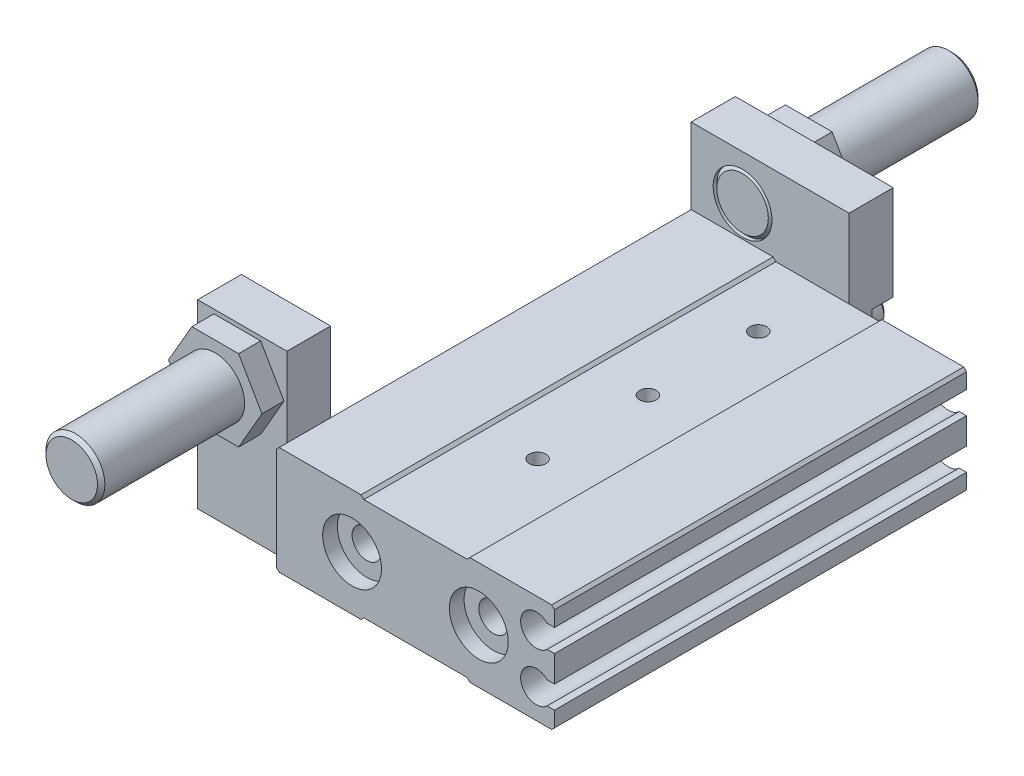
from build123d import *

# Parameters (mm, degrees)
BASE_EXTRUDE_START               = -56
BASE_EXTRUDE_DEPTH               = 56
SKETCH2_R                        = 4
CUT_EXTRUDE1_DEPTH               = 54.7
SKETCH4_R                        = 4
BOSS_EXTRUDE1_DEPTH              = 10
CUT_EXTRUDE3_REACH               = 59.681
SKETCH19_R                       = 2
F_4_40_TAPPED_HOLE2_D            = 2.2606
F_4_40_TAPPED_HOLE2_CBORE_D      = 2.8448
F_4_40_TAPPED_HOLE2_CBORE_DEPTH  = 5.6896
F_3_48_TAPPED_HOLE1_D            = 2.0828
F_3_48_TAPPED_HOLE1_DEPTH        = 7.3025
F_3_48_TAPPED_HOLE1_CBORE_D      = 2.5146
F_3_48_TAPPED_HOLE1_CBORE_DEPTH  = 5.0292
F_3_48_TAPPED_HOLE1_TIP          = 0.625736249
HOLE1_D                          = 3.1877
HOLE1_DEPTH                      = 2.54
CUT_EXTRUDE4_DEPTH               = 2.5
F_10_32_TAPPED_HOLE1_D           = 4.0386
F_10_32_TAPPED_HOLE1_DEPTH       = 12.0293892
F_10_32_TAPPED_HOLE1_CBORE_D     = 4.826
F_10_32_TAPPED_HOLE1_CBORE_DEPTH = 9.652
F_10_32_TAPPED_HOLE1_TIP         = 1.213317848
SKETCH30_W                       = 21.46
SKETCH30_H                       = 24.23
BOSS_EXTRUDE2_DEPTH              = 6
CUT_EXTRUDE9_DEPTH               = 2.87
BOSS_EXTRUDE3_DEPTH              = 3
SKETCH35_R                       = 2.032
BOSS_EXTRUDE5_DEPTH              = 3
BOSS_EXTRUDE6_DEPTH              = 5.94
BOSS_EXTRUDE7_DEPTH              = 3
CUT_EXTRUDE7_REACH               = 77.879
SKETCH38_R                       = 4
CUT_EXTRUDE8_REACH               = 95.429
SKETCH46_R                       = 4
CHAMFER3_SIZE                    = 0.5
CHAMFER4_SIZE                    = 0.5


with BuildPart() as part:
    # Sketch1 → Base-Extrude (new body)
    with BuildSketch(Plane(origin=(0, 0, 57.45), x_dir=(-1, 0, 0), z_dir=(0, 0, 1)).offset(BASE_EXTRUDE_START)):
        with BuildLine():
            Line((18.519, 7.3406), (18.9, 6.9596))
            Line((18.9, 6.9596), (18.9, -6.9596))
            Line((18.9, -6.9596), (18.519, -7.3406))
            Line((18.519, -7.3406), (7.3914, -7.3406))
            Line((7.3914, -7.3406), (7.0104, -6.9596))
            Line((7.0104, -6.9596), (-7.0104, -6.9596))
            Line((-7.0104, -6.9596), (-7.3914, -7.3406))
            Line((-7.3914, -7.3406), (-18.519, -7.3406))
            Line((-18.519, -7.3406), (-18.9, -6.9596))
            Line((-18.9, -6.9596), (-18.9, -4.8641))
            Line((-18.9, -4.8641), (-17.913735828, -4.8641))
            ThreePointArc((-17.913735828, -4.8641), (-14.3, -3.3274), (-17.913735828, -1.7907))
            Line((-17.913735828, -1.7907), (-18.9, -1.7907))
            Line((-18.9, -1.7907), (-18.9, 1.7907))
            Line((-18.9, 1.7907), (-17.913735828, 1.7907))
            ThreePointArc((-17.913735828, 1.7907), (-14.3, 3.3274), (-17.913735828, 4.8641))
            Line((-17.913735828, 4.8641), (-18.9, 4.8641))
            Line((-18.9, 4.8641), (-18.9, 6.9596))
            Line((-18.9, 6.9596), (-18.519, 7.3406))
            Line((-18.519, 7.3406), (-7.3914, 7.3406))
            Line((-7.3914, 7.3406), (-7.0104, 6.9596))
            Line((-7.0104, 6.9596), (7.0104, 6.9596))
            Line((7.0104, 6.9596), (7.3914, 7.3406))
            Line((7.3914, 7.3406), (18.519, 7.3406))
        make_face()
    extrude(amount=BASE_EXTRUDE_DEPTH)

    # Sketch2 → Cut-Extrude1 (cut)
    with BuildSketch(Plane(origin=(0, 0, 57.45), x_dir=(-1, 0, 0), z_dir=(0, 0, -1))):
        with Locations(Location((-8.6106, 0, 0), (0, 0, 180))):
            Circle(SKETCH2_R)
        with Locations(Location((8.6106, 0, 0), (0, 0, 180))):
            Circle(SKETCH2_R)
    extrude(amount=CUT_EXTRUDE1_DEPTH, mode=Mode.SUBTRACT)

    # Sketch4 → Boss-Extrude1 (add)
    with BuildSketch(Plane.XY.offset(55.45)):
        with Locations((8.6106, 0)):
            Circle(SKETCH4_R)
        with Locations((-8.6106, 0)):
            Circle(SKETCH4_R)
    extrude(amount=-BOSS_EXTRUDE1_DEPTH)

    # Sketch19 → Cut-Extrude3 (cut, up to next)
    with BuildSketch(Plane.XY.offset(55.45), mode=Mode.PRIVATE) as cut_extrude3_sk1:
        with Locations((8.6106, 0)):
            Circle(SKETCH19_R)
    cut_extrude3_tool1 = extrude(cut_extrude3_sk1.sketch, amount=-CUT_EXTRUDE3_REACH, mode=Mode.PRIVATE) & part.part
    # Sketch19 → Cut-Extrude3 (cut, up to next)
    with BuildSketch(Plane.XY.offset(55.45), mode=Mode.PRIVATE) as cut_extrude3_sk2:
        with Locations((-8.6106, 0)):
            Circle(SKETCH19_R)
    cut_extrude3_tool2 = extrude(cut_extrude3_sk2.sketch, amount=-CUT_EXTRUDE3_REACH, mode=Mode.PRIVATE) & part.part
    add(cut_extrude3_tool1.solids().sort_by_distance((8.6106, 0, 55.45))[0], mode=Mode.SUBTRACT)
    add(cut_extrude3_tool2.solids().sort_by_distance((-8.6106, 0, 55.45))[0], mode=Mode.SUBTRACT)

    # #4-40 Tapped Hole2 (through all)
    with Locations(Plane.XZ.offset(6.9596)):
        with Locations((0, 40.85), (0, 25.85), (0, 10.85)):
            CounterBoreHole(F_4_40_TAPPED_HOLE2_D / 2, F_4_40_TAPPED_HOLE2_CBORE_D / 2, F_4_40_TAPPED_HOLE2_CBORE_DEPTH)

    # #3-48 Tapped Hole1
    with Locations(Plane(origin=(0, 0, 1.45), x_dir=(-1, 0, 0), z_dir=(0, 0, -1))):
        with Locations((16, -4.6406), (16, 4.3594), (-0.002, -4.6406), (-0.002, 2.3594)):
            CounterBoreHole(F_3_48_TAPPED_HOLE1_D / 2, F_3_48_TAPPED_HOLE1_CBORE_D / 2, F_3_48_TAPPED_HOLE1_CBORE_DEPTH, depth=F_3_48_TAPPED_HOLE1_DEPTH)
            with Locations((0, 0, -(F_3_48_TAPPED_HOLE1_DEPTH + F_3_48_TAPPED_HOLE1_TIP / 2))):  # 118° drill point
                Cone(0, F_3_48_TAPPED_HOLE1_D / 2, F_3_48_TAPPED_HOLE1_TIP, mode=Mode.SUBTRACT)

    # Hole1
    with Locations(Plane.XZ.offset(7.3406)):
        with Locations((-14, 42.15)):
            Hole(HOLE1_D / 2, depth=HOLE1_DEPTH)

    # Sketch27 → Cut-Extrude4 (cut)
    with BuildSketch(Plane.XZ.offset(7.3406)):
        with BuildLine():
            Line((-15.59385, 14.55615), (-15.59385, 13.74385))
            ThreePointArc((-15.59385, 13.74385), (-14, 12.15), (-12.40615, 13.74385))
            Line((-12.40615, 13.74385), (-12.40615, 14.55615))
            ThreePointArc((-12.40615, 14.55615), (-14, 16.15), (-15.59385, 14.55615))
        make_face()
    extrude(amount=-CUT_EXTRUDE4_DEPTH, mode=Mode.SUBTRACT)

    # #10-32 Tapped Hole1
    with Locations(Plane.ZY.offset(18.9)):
        with Locations((44.95, -0.1406)):
            CounterBoreHole(F_10_32_TAPPED_HOLE1_D / 2, F_10_32_TAPPED_HOLE1_CBORE_D / 2, F_10_32_TAPPED_HOLE1_CBORE_DEPTH, depth=F_10_32_TAPPED_HOLE1_DEPTH)
            with Locations((0, 0, -(F_10_32_TAPPED_HOLE1_DEPTH + F_10_32_TAPPED_HOLE1_TIP / 2))):  # 118° drill point
                Cone(0, F_10_32_TAPPED_HOLE1_D / 2, F_10_32_TAPPED_HOLE1_TIP, mode=Mode.SUBTRACT)

    # Sketch30 → Boss-Extrude2 (add)
    with BuildSketch(Plane(origin=(0, 0, 1.45), x_dir=(-1, 0, 0), z_dir=(0, 0, -1))):
        with Locations((7.789, 5.5364)):
            Rectangle(SKETCH30_W, SKETCH30_H)
    extrude(amount=BOSS_EXTRUDE2_DEPTH)

    # Sketch48 → Cut-Extrude9 (cut)
    with BuildSketch(Plane(origin=(0, 0, -4.55), x_dir=(-1, 0, 0), z_dir=(0, 0, -1))):
        with BuildLine():
            Line((16, 6.7744), (18.519, 6.7744))
            Line((18.519, 6.7744), (18.519, 1.9444))
            Line((18.519, 1.9444), (16, 1.9444))
            ThreePointArc((16, 1.9444), (13.585, 4.3594), (16, 6.7744))
        make_face()
        with BuildLine():
            Line((2.413, -4.6406), (2.413, -6.5786))
            Line((2.413, -6.5786), (-2.941, -6.5786))
            Line((-2.941, -6.5786), (-2.941, -2.2256))
            Line((-2.941, -2.2256), (-0.002, -2.2256))
            ThreePointArc((-0.002, -2.2256), (1.705662877, -2.932937123), (2.413, -4.6406))
        make_face()
        with BuildLine():
            Line((16, -2.2256), (18.519, -2.2256))
            Line((18.519, -2.2256), (18.519, -6.5786))
            Line((18.519, -6.5786), (13.585, -6.5786))
            Line((13.585, -6.5786), (13.585, -4.6406))
            ThreePointArc((13.585, -4.6406), (14.292337123, -2.932937123), (16, -2.2256))
        make_face()
        with BuildLine():
            Line((-0.002, 4.7744), (-2.941, 4.7744))
            Line((-2.941, 4.7744), (-2.941, -0.0556))
            Line((-2.941, -0.0556), (-0.002, -0.0556))
            ThreePointArc((-0.002, -0.0556), (2.413, 2.3594), (-0.002, 4.7744))
        make_face()
    extrude(amount=-CUT_EXTRUDE9_DEPTH, mode=Mode.SUBTRACT)

    # Sketch31 → Boss-Extrude3 (add)
    with BuildSketch(Plane(origin=(0, 0, -4.55), x_dir=(-1, 0, 0), z_dir=(0, 0, -1))):
        Polygon((17.889852961, 11.5714), (14.714426481, 17.0714), (8.363573519, 17.0714), (5.188147039, 11.5714), (8.363573519, 6.0714), (14.714426481, 6.0714), align=None)
    extrude(amount=BOSS_EXTRUDE3_DEPTH)

    # Sketch35 → Boss-Extrude5 (add)
    with BuildSketch(Plane(origin=(0, 0, -1.68), x_dir=(-1, 0, 0), z_dir=(0, 0, -1))):
        with Locations((16, 4.3594)):
            Circle(SKETCH35_R)
        with Locations((-0.002, 2.3594)):
            Circle(SKETCH35_R)
        with Locations(Location((-0.002, -4.6406, 0), (0, 0, 252.504422298))):
            Circle(SKETCH35_R)
        with Locations(Location((16, -4.6406, 0), (0, 0, 252.504422298))):
            Circle(SKETCH35_R)
    extrude(amount=BOSS_EXTRUDE5_DEPTH)

    # Sketch36 → Boss-Extrude6 (add)
    with BuildSketch(Plane.XY.offset(49.95)):
        Polygon((-19.027, 17.6394), (-19.027, 5.3406), (-18.9, 5.3406), (-18.9, -6.9706), (-31.15, -6.9706), (-31.15, 17.6394), align=None)
    extrude(amount=BOSS_EXTRUDE6_DEPTH)

    # Sketch37 → Boss-Extrude7 (add)
    with BuildSketch(Plane.XY.offset(55.89)):
        Polygon((-22.594573519, 17.0714), (-28.945426481, 17.0714), (-32.120852961, 11.5714), (-28.945426481, 6.0714), (-22.594573519, 6.0714), (-19.419147039, 11.5714), align=None)
    extrude(amount=BOSS_EXTRUDE7_DEPTH)

    # Sketch38 → Cut-Extrude7 (cut, up to next)
    with BuildSketch(Plane.XY.offset(58.89), mode=Mode.PRIVATE) as cut_extrude7_sk1:
        with Locations((-25.77, 11.5714)):
            Circle(SKETCH38_R)
    cut_extrude7_tool1 = extrude(cut_extrude7_sk1.sketch, amount=-CUT_EXTRUDE7_REACH, mode=Mode.PRIVATE) & part.part
    add(cut_extrude7_tool1.solids().sort_by_distance((-25.77, 11.5714, 58.89))[0], mode=Mode.SUBTRACT)

    # Sketch44 → Boss-Revolve1 (revolve)
    with BuildSketch(Plane(origin=(0, 11.5714, 0), x_dir=(-1, 0, 0), z_dir=(0, 1, 0)), mode=Mode.PRIVATE) as boss_revolve1_sk:
        Polygon((25.77, 78.39), (29.77, 78.39), (29.77, 50.45), (29.27, 49.95), (25.77, 49.95), align=None)
    revolve(boss_revolve1_sk.sketch.rotate(Axis((-25.77, 11.5714, 58.89), (0, 0, -1)), 180), axis=Axis((-25.77, 11.5714, 58.89), (0, 0, -1)))

    # Sketch46 → Cut-Extrude8 (cut, up to next)
    with BuildSketch(Plane(origin=(0, 0, -7.55), x_dir=(-1, 0, 0), z_dir=(0, 0, -1)), mode=Mode.PRIVATE) as cut_extrude8_sk1:
        with Locations((11.539, 11.5714)):
            Circle(SKETCH46_R)
    cut_extrude8_tool1 = extrude(cut_extrude8_sk1.sketch, amount=-CUT_EXTRUDE8_REACH, mode=Mode.PRIVATE) & part.part
    add(cut_extrude8_tool1.solids().sort_by_distance((-11.539, 11.5714, -7.55))[0], mode=Mode.SUBTRACT)

    # Sketch47 → Boss-Revolve2 (revolve)
    with BuildSketch(Plane(origin=(0, 11.5714, 0), x_dir=(-1, 0, 0), z_dir=(0, 1, 0))):
        Polygon((15.039, 1.45), (11.539, 1.45), (11.539, -27.05), (15.539, -27.05), (15.539, 0.95), align=None)
    revolve(axis=Axis((-11.539, 11.5714, 1.45), (0, 0, -1)))

    # Chamfer3
    chamfer3_edges = [part.edges().sort_by_distance(p)[0] for p in [
        (-29.77, 11.5714, 78.39),
        (-7.539, 11.5714, -27.05),
    ]]
    chamfer(chamfer3_edges, length=CHAMFER3_SIZE)

    # Chamfer4
    chamfer4_edges = [part.edges().sort_by_distance(p)[0] for p in [
        (-13.968, 4.3594, -4.68),
        (2.034, 2.3594, -4.68),
        (-0.608884604, -2.7026, -4.68),
        (-16.610884604, -2.7026, -4.68),
    ]]
    chamfer(chamfer4_edges, length=CHAMFER4_SIZE)


solid = part.part
